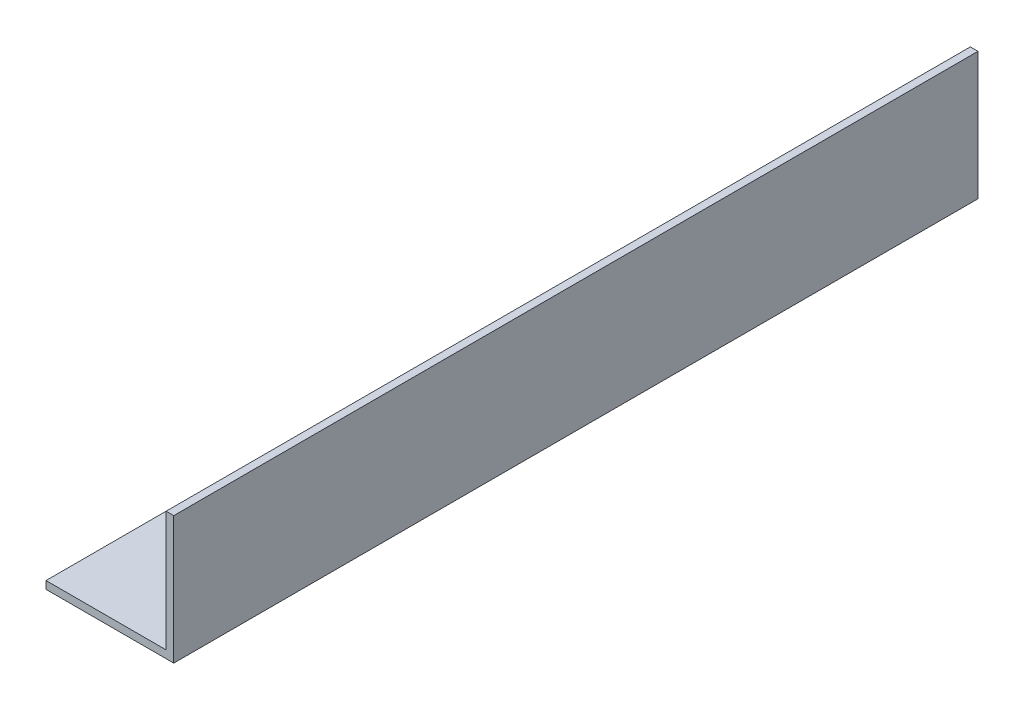
from build123d import *

# Parameters (mm, degrees)
BOSS_EXTRUDE1_DEPTH      = 10
BOSS_EXTRUDE1_DEPTH_BACK = 304.8
SKETCH4_R                = 2.585
CUT_EXTRUDE1_DEPTH       = 313.894614847


with BuildPart() as part:
    # Sketch3 → Boss-Extrude1 (new, two sides: drawn at the far end of the back side and taken through both)
    with BuildSketch(Plane.XY.offset(-BOSS_EXTRUDE1_DEPTH_BACK)):
        Polygon((-50, 0), (0, 0), (0, 50), (-3, 50), (-3, 3), (-50, 3), align=None)
    extrude(amount=BOSS_EXTRUDE1_DEPTH + BOSS_EXTRUDE1_DEPTH_BACK)

    # Sketch4 → Cut-Extrude1 (cut, through all)
    with BuildSketch(Plane(origin=(0, 0, 0), x_dir=(1, 0, 0), z_dir=(0, 1, 0))):
        with Locations(Location((-37, 156.19, 0), (0, 0, 180))):
            Circle(SKETCH4_R)
        with Locations(Location((-16, 156.19, 0), (0, 0, 90))):
            Circle(SKETCH4_R)
        with Locations(Location((-37, 184.19, 0), (0, 0, 180))):
            Circle(SKETCH4_R)
        with Locations(Location((-16, 184.19, 0), (0, 0, 90))):
            Circle(SKETCH4_R)
        with Locations(Location((-37, 110.61, 0), (0, 0, 90))):
            Circle(SKETCH4_R)
        with Locations(Location((-16, 110.61, 0), (0, 0, 180))):
            Circle(SKETCH4_R)
        with Locations(Location((-16, 138.61, 0), (0, 0, 180))):
            Circle(SKETCH4_R)
        with Locations(Location((-37, 138.61, 0), (0, 0, 90))):
            Circle(SKETCH4_R)
    extrude(amount=CUT_EXTRUDE1_DEPTH, mode=Mode.SUBTRACT)


solid = part.part
